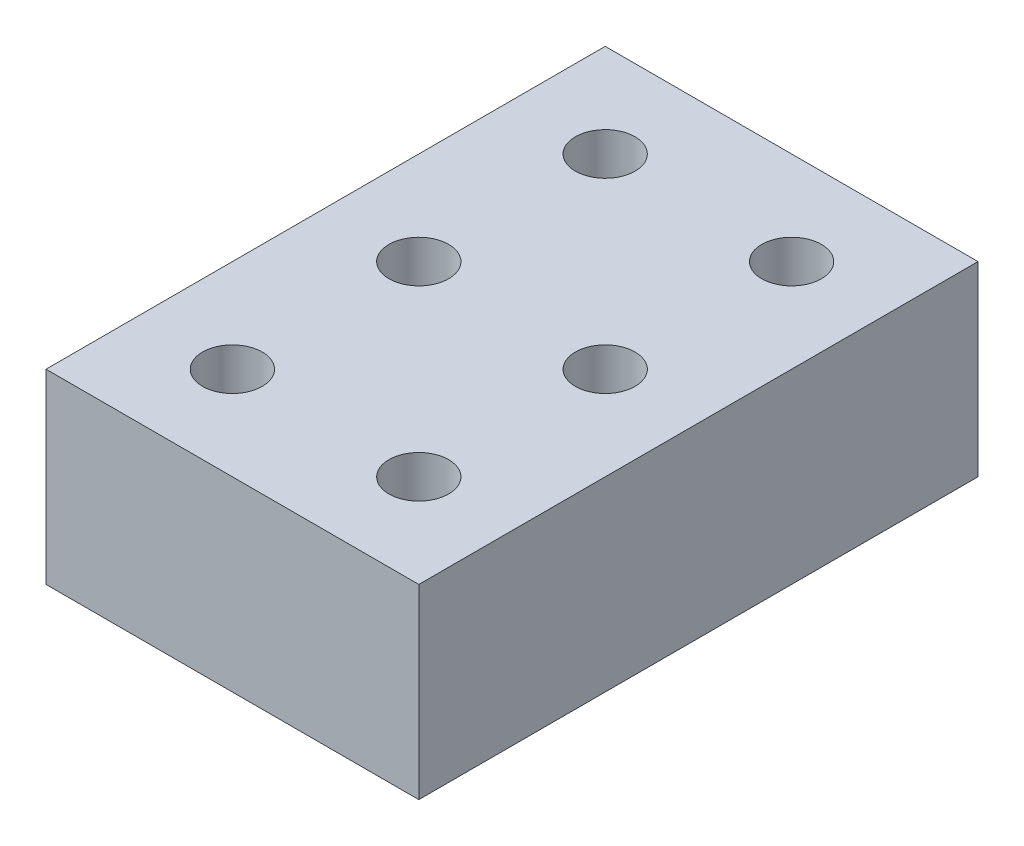
from build123d import *

# Parameters (mm, degrees)
SKETCH_1_W      = 20
SKETCH_1_H      = 30
SKETCH_1_R      = 1.6
EXTRUDE_1_DEPTH = 10


with BuildPart() as part:
    # 草图1 → 凸台-拉伸1 (new body)
    with BuildSketch(Plane(origin=(0, 0, 0), x_dir=(1, 0, 0), z_dir=(0, 1, 0))):
        Rectangle(SKETCH_1_W, SKETCH_1_H)
        with Locations(Location((-5, 0, 0), (0, 0, 270))):
            Circle(SKETCH_1_R, mode=Mode.SUBTRACT)
        with Locations(Location((-5, 10, 0), (0, 0, 270))):
            Circle(SKETCH_1_R, mode=Mode.SUBTRACT)
        with Locations(Location((-5, -10, 0), (0, 0, 270))):
            Circle(SKETCH_1_R, mode=Mode.SUBTRACT)
        with Locations(Location((5, -10, 0), (0, 0, 90))):
            Circle(SKETCH_1_R, mode=Mode.SUBTRACT)
        with Locations(Location((5, 0, 0), (0, 0, 90))):
            Circle(SKETCH_1_R, mode=Mode.SUBTRACT)
        with Locations(Location((5, 10, 0), (0, 0, 90))):
            Circle(SKETCH_1_R, mode=Mode.SUBTRACT)
    extrude(amount=EXTRUDE_1_DEPTH)


solid = part.part
